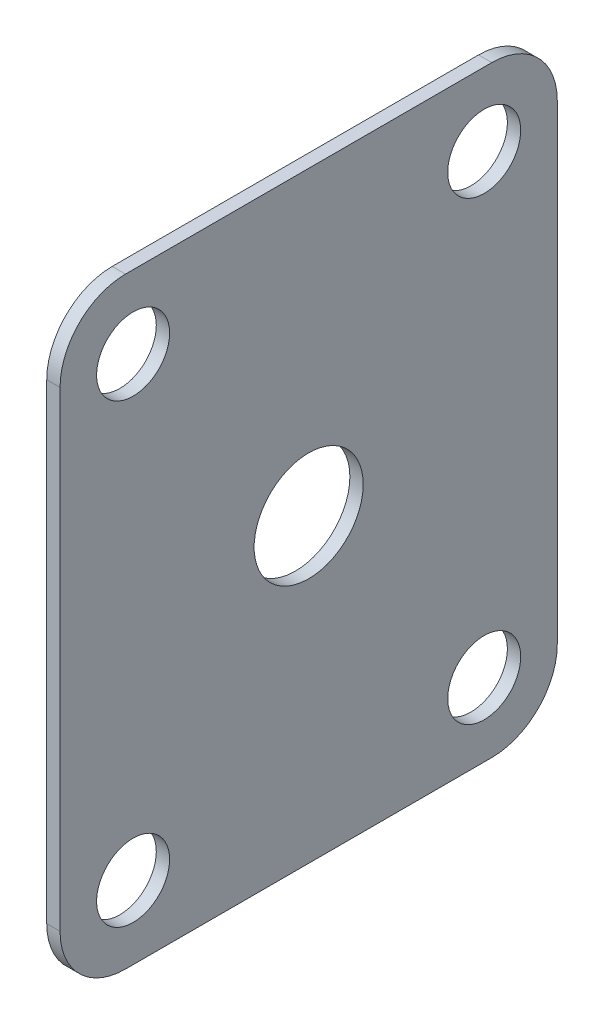
from build123d import *

# Parameters (mm, degrees)
SKETCH1_W           = 57.912
SKETCH1_H           = 70.104
SKETCH1_R           = 4.25
SKETCH1_R_2         = 6.35
BOSS_EXTRUDE1_DEPTH = 1.5494
FILLET1_R           = 7.62


with BuildPart() as part:
    # Sketch1 → Boss-Extrude1 (new body)
    with BuildSketch(Plane(origin=(0, 0, 0), x_dir=(0, 0, -1), z_dir=(1, 0, 0))):
        Rectangle(SKETCH1_W, SKETCH1_H)
        with Locations((-20.447, 26.543)):
            Circle(SKETCH1_R, mode=Mode.SUBTRACT)
        with Locations((20.447, 26.543)):
            Circle(SKETCH1_R, mode=Mode.SUBTRACT)
        with Locations((20.447, -26.543)):
            Circle(SKETCH1_R, mode=Mode.SUBTRACT)
        with Locations((-20.447, -26.543)):
            Circle(SKETCH1_R, mode=Mode.SUBTRACT)
        Circle(SKETCH1_R_2, mode=Mode.SUBTRACT)
    extrude(amount=BOSS_EXTRUDE1_DEPTH)

    # Fillet1
    fillet1_edges = [part.edges().sort_by_distance(p)[0] for p in [
        (0.7747, -35.052, -28.956),
        (0.7747, -35.052, 28.956),
        (0.7747, 35.052, 28.956),
        (0.7747, 35.052, -28.956),
    ]]
    fillet(fillet1_edges, radius=FILLET1_R)


solid = part.part
